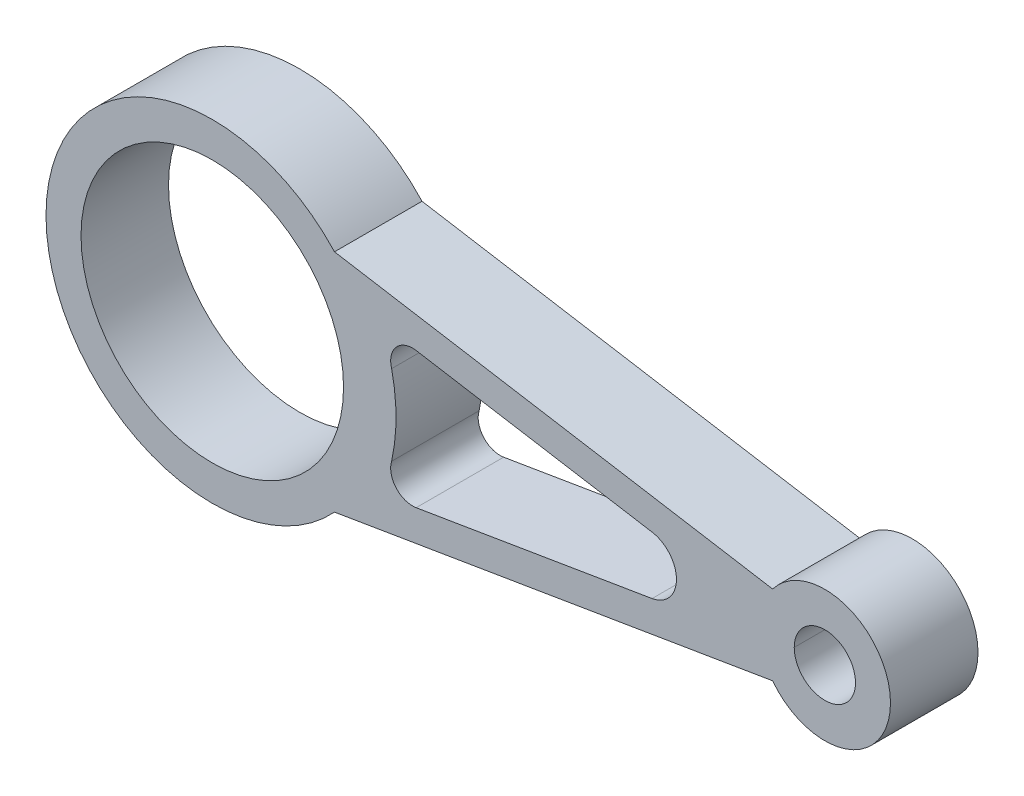
from build123d import *

# Parameters (mm, degrees)
SKETCH1_R           = 30
SKETCH1_R_2         = 7
BOSS_EXTRUDE1_DEPTH = 10
CUT_EXTRUDE1_DEPTH  = 161.838428244


with BuildPart() as part:
    # Sketch1 → Boss-Extrude1 (new, symmetric)
    with BuildSketch(Plane.XY):
        with BuildLine():
            Line((27.935473676, -25.760615491), (128.063755469, -9.084385863))
            ThreePointArc((128.063755469, -9.084385863), (155, 0), (128.063755469, 9.084385863))
            Line((128.063755469, 9.084385863), (27.935473676, 25.760615491))
            ThreePointArc((27.935473676, 25.760615491), (-38, 0), (27.935473676, -25.760615491))
        make_face()
        Circle(SKETCH1_R, mode=Mode.SUBTRACT)
        with Locations((140, 0)):
            Circle(SKETCH1_R_2, mode=Mode.SUBTRACT)
    extrude(amount=BOSS_EXTRUDE1_DEPTH, both=True)

    # Sketch2 → Cut-Extrude1 (cut, through all)
    with BuildSketch(Plane.XY.offset(10)):
        with BuildLine():
            Line((46.591424383, 15.557071672), (100.514303988, 6.576289156))
            ThreePointArc((100.514303988, 6.576289156), (106.085905266, 0), (100.514303988, -6.576289156))
            Line((100.514303988, -6.576289156), (46.591424383, -15.557071672))
            ThreePointArc((46.591424383, -15.557071672), (42.010455779, -13.921347897), (40.987646035, -9.165853617))
            ThreePointArc((40.987646035, -9.165853617), (42, 0), (40.987646035, 9.165853617))
            ThreePointArc((40.987646035, 9.165853617), (42.010455779, 13.921347897), (46.591424383, 15.557071672))
        make_face()
    extrude(amount=-CUT_EXTRUDE1_DEPTH, mode=Mode.SUBTRACT)


solid = part.part
